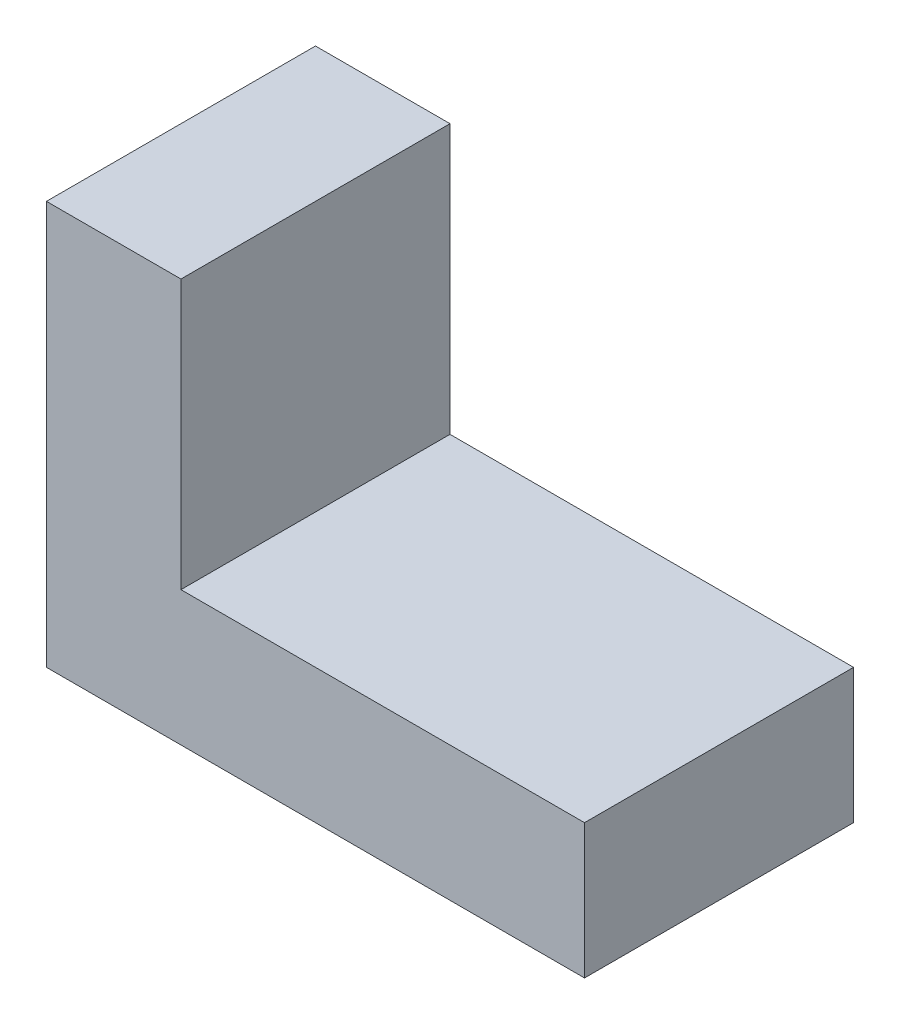
from build123d import *

# Parameters (mm, degrees)
BOSS_EXTRUDE1_DEPTH = 10


with BuildPart() as part:
    # Sketch1 → Boss-Extrude1 (new body)
    with BuildSketch(Plane.XY.offset(20)):
        Polygon((5, 5), (25, 5), (25, 10), (10, 10), (10, 20), (5, 20), align=None)
    extrude(amount=BOSS_EXTRUDE1_DEPTH)


solid = part.part
